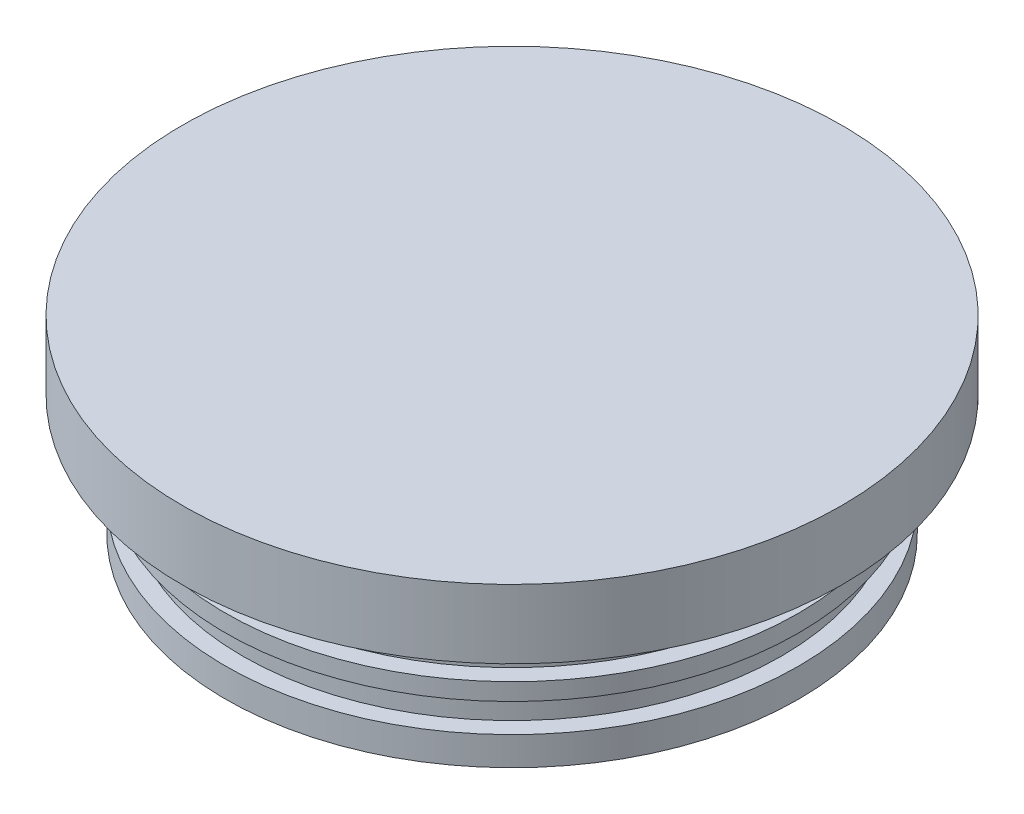
from build123d import *


with BuildPart() as part:
    # Esquisse1 → Révolution1 (revolve)
    with BuildSketch(Plane.XY):
        Polygon((0, 0), (45, 0), (45, -27), (50, -27), (50, -22), (47, -22), (47, -17), (50, -17), (50, -14), (47, -14), (47, -9), (50, -9), (50, -6), (57.5, -6), (57.5, 6), (0, 6), align=None)
    revolve(axis=Axis((0, 0, 0), (0, 1, 0)))


solid = part.part
